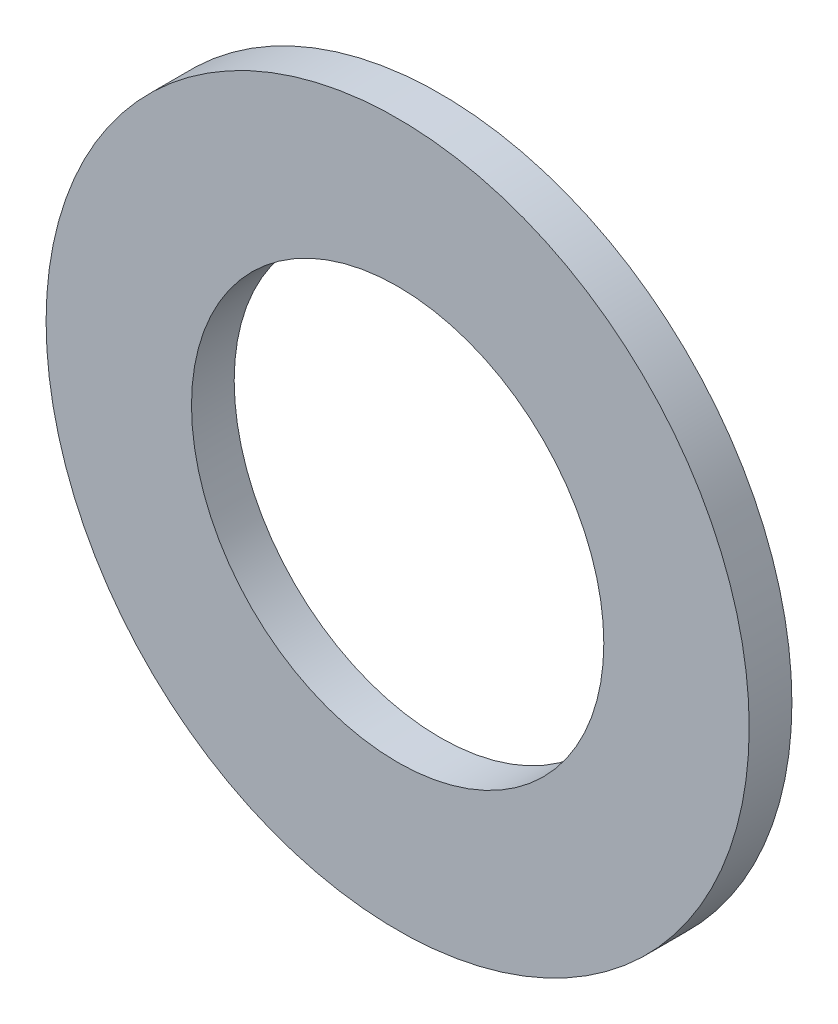
from build123d import *

# Parameters (mm, degrees)
SKETCH1_R           = 11.9366207
SKETCH1_R_2         = 7
BOSS_EXTRUDE1_DEPTH = 1.45


with BuildPart() as part:
    # Sketch1 → Boss-Extrude1 (new body)
    with BuildSketch(Plane.XY):
        Circle(SKETCH1_R)
        Circle(SKETCH1_R_2, mode=Mode.SUBTRACT)
    extrude(amount=BOSS_EXTRUDE1_DEPTH)


solid = part.part
